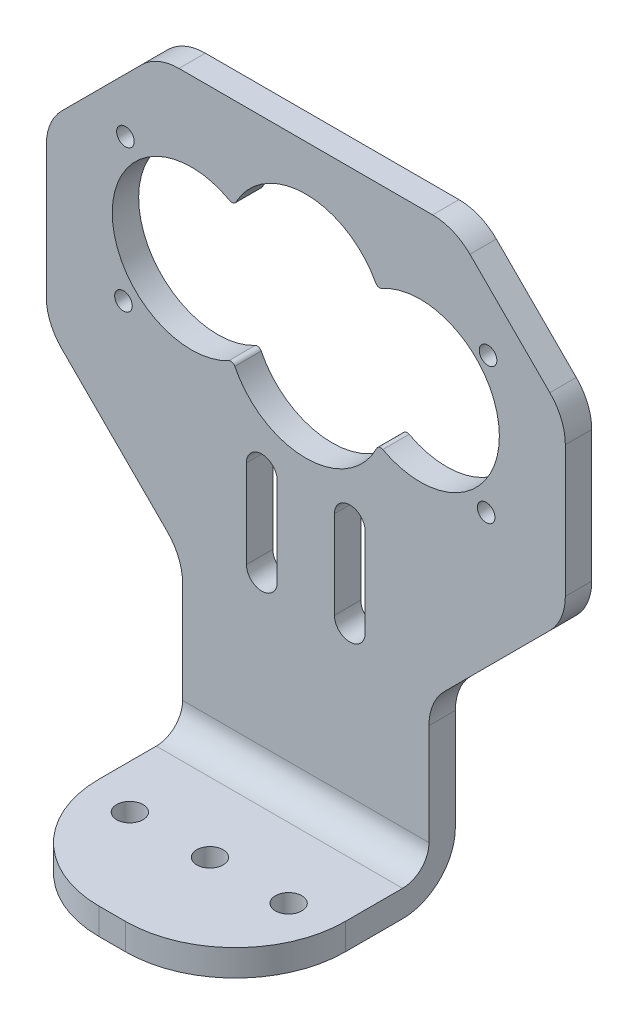
from build123d import *

# Parameters (mm, degrees)
SKETCH1_W           = 28
SKETCH1_H           = 25
BOSS_EXTRUDE1_DEPTH = 3
FILLET1_R           = 12.5
SKETCH2_W           = 28
SKETCH2_H           = 3
BOSS_EXTRUDE2_DEPTH = 65
SKETCH3_W           = 3
SKETCH3_H           = 48
BOSS_EXTRUDE3_DEPTH = 15.5
SKETCH4_W           = 3
SKETCH4_H           = 48
BOSS_EXTRUDE4_DEPTH = 15.5
SKETCH9_W           = 14.741294127
SKETCH9_H           = 6.665628648
CUT_EXTRUDE1_DEPTH  = 3
SKETCH6_R           = 9
CUT_EXTRUDE2_DEPTH  = 3
CUT_EXTRUDE4_DEPTH  = 3
CUT_EXTRUDE5_DEPTH  = 3
CUT_EXTRUDE8_DEPTH  = 3
FILLET3_R           = 3
FILLET4_R           = 6
FILLET5_R           = 6
FILLET6_R           = 6
FILLET7_R           = 0.5
SKETCH13_R          = 1.5
CUT_EXTRUDE10_DEPTH = 3
SKETCH14_R          = 1
CUT_EXTRUDE11_DEPTH = 3


with BuildPart() as part:
    # Sketch1 → Boss-Extrude1 (new body)
    with BuildSketch(Plane(origin=(0, 0, 0), x_dir=(1, 0, 0), z_dir=(0, 1, 0))):
        Rectangle(SKETCH1_W, SKETCH1_H)
    extrude(amount=BOSS_EXTRUDE1_DEPTH)

    # Fillet1
    fillet1_edges = [part.edges().sort_by_distance(p)[0] for p in [
        (14, 1.5, 12.5),
        (-14, 1.5, 12.5),
    ]]
    fillet(fillet1_edges, radius=FILLET1_R)

    # Sketch2 → Boss-Extrude2 (add)
    with BuildSketch(Plane(origin=(0, 3, 0), x_dir=(1, 0, 0), z_dir=(0, 1, 0))):
        with Locations((0, 11)):
            Rectangle(SKETCH2_W, SKETCH2_H)
    extrude(amount=BOSS_EXTRUDE2_DEPTH)

    # Sketch3 → Boss-Extrude3 (add)
    with BuildSketch(Plane(origin=(14, 0, 0), x_dir=(0, 0, -1), z_dir=(1, 0, 0))):
        with Locations((11, 44)):
            Rectangle(SKETCH3_W, SKETCH3_H)
    extrude(amount=BOSS_EXTRUDE3_DEPTH)

    # Sketch4 → Boss-Extrude4 (add)
    with BuildSketch(Plane.ZY.offset(14)):
        with Locations((-11, 44)):
            Rectangle(SKETCH4_W, SKETCH4_H)
    extrude(amount=BOSS_EXTRUDE4_DEPTH)

    # Sketch9 → Cut-Extrude1 (cut)
    with BuildSketch(Plane.XY.offset(-9.5)):
        with Locations((0.406189009, 49.915136893)):
            Rectangle(SKETCH9_W, SKETCH9_H)
    extrude(amount=-CUT_EXTRUDE1_DEPTH, mode=Mode.SUBTRACT)

    # Sketch6 → Cut-Extrude2 (cut)
    with BuildSketch(Plane.XY.offset(-9.5)):
        with Locations((-13, 50)):
            Circle(SKETCH6_R)
        with Locations((13, 50)):
            Circle(SKETCH6_R)
    extrude(amount=-CUT_EXTRUDE2_DEPTH, mode=Mode.SUBTRACT)

    # Sketch10 → Cut-Extrude4 (cut)
    with BuildSketch(Plane.XY.offset(-9.5)):
        with BuildLine():
            ThreePointArc((4.712414346, 53.509405082), (6.133712339, 55.818427086), (8.178203975, 57.599360703))
            ThreePointArc((8.178203975, 57.599360703), (-3.213e-05, 62.842256013), (-8.178312295, 57.599429431))
            ThreePointArc((-8.178312295, 57.599429431), (-6.134043572, 55.818817949), (-4.71276392, 53.5102305))
            ThreePointArc((-4.71276392, 53.5102305), (-5.8098e-05, 54.842256016), (4.712414346, 53.509405082))
        make_face()
        with BuildLine():
            ThreePointArc((-8.28808236, 42.332025551), (-0.000398085, 36.842256062), (8.286739374, 42.332850969))
            ThreePointArc((8.286739374, 42.332850969), (6.264272315, 44.030915266), (4.821726078, 46.24289531))
            ThreePointArc((4.821726078, 46.24289531), (-5.805e-06, 44.842256013), (-4.821757652, 46.242826582))
            ThreePointArc((-4.821757652, 46.242826582), (-6.264820173, 44.030297102), (-8.28808236, 42.332025551))
        make_face()
        with BuildLine():
            ThreePointArc((-4.821757652, 46.242826582), (-5.805e-06, 44.842256013), (4.821726078, 46.24289531))
            ThreePointArc((4.821726078, 46.24289531), (4.746201964, 46.41185034), (4.674167851, 46.582322569))
            Line((4.674167851, 46.582322569), (-4.674167851, 46.582322569))
            ThreePointArc((-4.674167851, 46.582322569), (-4.746217041, 46.411815659), (-4.821757652, 46.242826582))
        make_face()
        with BuildLine():
            ThreePointArc((4.606501749, 53.247951217), (4.658433625, 53.379093134), (4.712414346, 53.509405082))
            ThreePointArc((4.712414346, 53.509405082), (-5.8098e-05, 54.842256016), (-4.71276392, 53.5102305))
            ThreePointArc((-4.71276392, 53.5102305), (-4.658601912, 53.379508536), (-4.606501749, 53.247951217))
            Line((-4.606501749, 53.247951217), (4.606501749, 53.247951217))
        make_face()
    extrude(amount=-CUT_EXTRUDE4_DEPTH, mode=Mode.SUBTRACT)

    # Sketch11 → Cut-Extrude5 (cut)
    with BuildSketch(Plane.XY.offset(-9.5)):
        Polygon((-29.5, 55.4), (-16.9, 68), (-29.5, 68), align=None)
        Polygon((29.5, 55.4), (29.5, 68), (16.9, 68), align=None)
        Polygon((14, 20), (29.5, 20), (29.5, 35.5), align=None)
        Polygon((-14, 20), (-29.5, 20), (-29.5, 35.5), align=None)
    extrude(amount=-CUT_EXTRUDE5_DEPTH, mode=Mode.SUBTRACT)

    # Sketch12 → Cut-Extrude8 (cut)
    with BuildSketch(Plane.XY.offset(-9.5)):
        with BuildLine():
            Line((-3.25, 33), (-3.25, 23))
            ThreePointArc((-3.25, 23), (-5, 21.25), (-6.75, 23))
            Line((-6.75, 23), (-6.75, 33))
            ThreePointArc((-6.75, 33), (-5, 34.75), (-3.25, 33))
        make_face()
        with BuildLine():
            Line((6.75, 33), (6.75, 23))
            ThreePointArc((6.75, 23), (5, 21.25), (3.25, 23))
            Line((3.25, 23), (3.25, 33))
            ThreePointArc((3.25, 33), (5, 34.75), (6.75, 33))
        make_face()
    extrude(amount=-CUT_EXTRUDE8_DEPTH, mode=Mode.SUBTRACT)

    # Fillet3
    fillet3_edges = [part.edges().sort_by_distance(p)[0] for p in [
        (0, 3, -9.5),
    ]]
    fillet(fillet3_edges, radius=FILLET3_R)

    # Fillet4
    fillet4_edges = [part.edges().sort_by_distance(p)[0] for p in [
        (0, 0, -12.5),
    ]]
    fillet(fillet4_edges, radius=FILLET4_R)

    # Fillet5
    fillet5_edges = [part.edges().sort_by_distance(p)[0] for p in [
        (-14, 20, -11),
        (14, 20, -11),
    ]]
    fillet(fillet5_edges, radius=FILLET5_R)

    # Fillet6
    fillet6_edges = [part.edges().sort_by_distance(p)[0] for p in [
        (-29.5, 55.4, -11),
        (-16.9, 68, -11),
        (29.5, 55.4, -11),
        (16.9, 68, -11),
        (29.5, 35.5, -11),
        (-29.5, 35.5, -11),
    ]]
    fillet(fillet6_edges, radius=FILLET6_R)

    # Fillet7
    fillet7_edges = [part.edges().sort_by_distance(p)[0] for p in [
        (-8.28808236, 42.332025551, -11),
        (8.286739374, 42.332850969, -11),
        (-8.178312295, 57.599429431, -11),
        (8.178203975, 57.599360703, -11),
    ]]
    fillet(fillet7_edges, radius=FILLET7_R)

    # Sketch13 → Cut-Extrude10 (cut)
    with BuildSketch(Plane(origin=(0, 3, 0), x_dir=(1, 0, 0), z_dir=(0, 1, 0))):
        with Locations(Location((0, -1.396515007, 0), (0, 0, 270))):
            Circle(SKETCH13_R)
        with Locations(Location((8.999836974, -1.450685505, 0), (0, 0, 270))):
            Circle(SKETCH13_R)
        with Locations(Location((-8.999405212, -1.499984009, 0), (0, 0, 270))):
            Circle(SKETCH13_R)
    extrude(amount=-CUT_EXTRUDE10_DEPTH, mode=Mode.SUBTRACT)

    # Sketch14 → Cut-Extrude11 (cut)
    with BuildSketch(Plane.XY.offset(-9.5)):
        with Locations((-20.5, 58.25)):
            Circle(SKETCH14_R)
        with Locations((-20.724916228, 41.960213357)):
            Circle(SKETCH14_R)
        with Locations((20.5, 41.75)):
            Circle(SKETCH14_R)
        with Locations((20.715004912, 57.321949454)):
            Circle(SKETCH14_R)
    extrude(amount=-CUT_EXTRUDE11_DEPTH, mode=Mode.SUBTRACT)


solid = part.part
